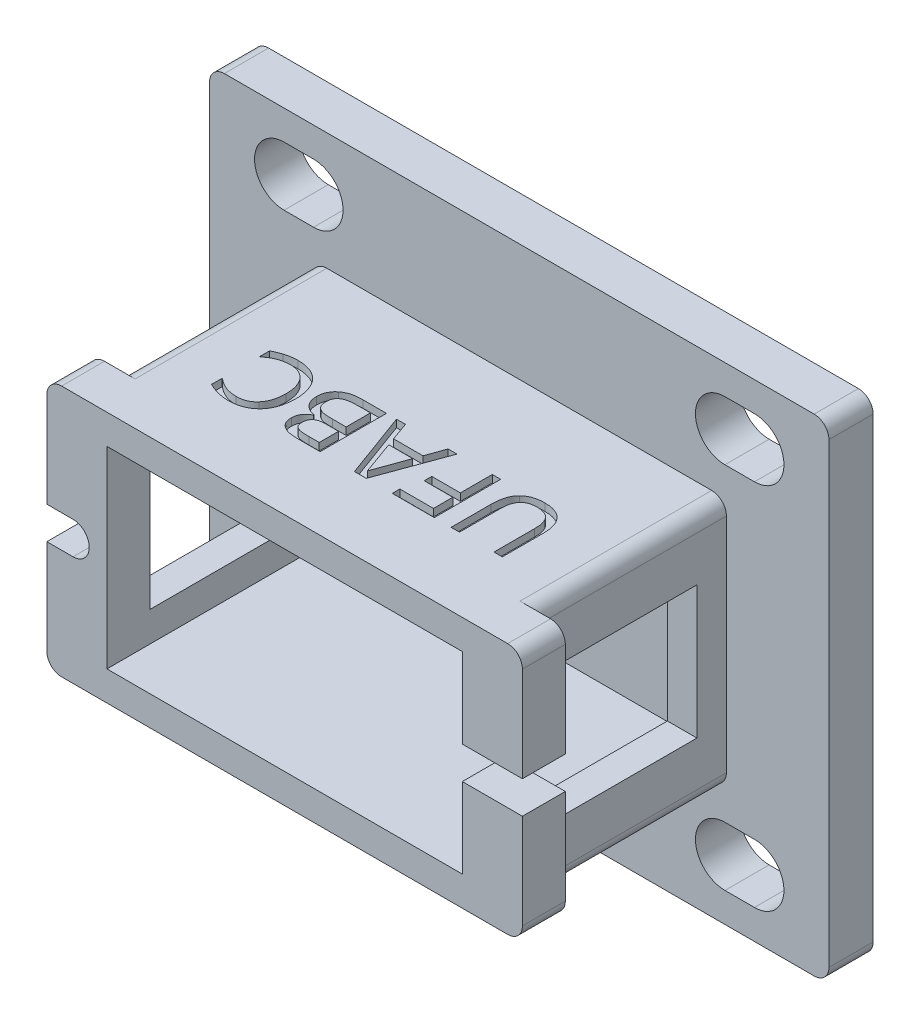
from build123d import *

# Parameters (mm, degrees)
RESSALTO_EXTRUS_O1_DEPTH      = 3
ESBO_O2_W                     = 28.1
ESBO_O2_H                     = 17.08
ESBO_O2_W_2                   = 24.1
ESBO_O2_H_2                   = 13.07
RESSALTO_EXTRUS_O2_DEPTH      = 15.91
RESSALTO_EXTRUS_O3_DEPTH      = 2.91
FURO_COM_FOLGA_DE_00002_D     = 2.199999918
FURO_COM_FOLGA_DE_00002_DEPTH = 4
FURO_COM_FOLGA_DE_00002_TIP   = 0.660946656
CORTE_EXTRUS_O5_DEPTH         = 10
ESPELHAR7_COPY_1_DEPTH        = 10
ESPELHAR7_COPY_2_DEPTH        = 10
CORTE_EXTRUS_O7_START         = -10
CORTE_EXTRUS_O7_DEPTH         = 10
FILETE3_R                     = 1
FILETE4_R                     = 1
FILETE5_R                     = 1
FILETE6_R                     = 1
ESBO_O21_W                    = 11
ESBO_O21_H                    = 9
CORTE_EXTRUS_O8_DEPTH         = 4
CORTE_EXTRUS_O9_DEPTH         = 0.5
CORTE_EXTRUS_O10_DEPTH        = 0.5
ESBO_O25_W                    = 2.3
ESBO_O25_H                    = 2.2
CORTE_EXTRUS_O11_DEPTH        = 3


with BuildPart() as part:
    # Esboço1 → Ressalto-extrusão1 (new body)
    with BuildSketch(Plane.XY):
        with BuildLine():
            Line((-14.468542564, 35.935043394), (25.531457436, 35.935043394))
            ThreePointArc((25.531457436, 35.935043394), (26.238564217, 35.642150175), (26.531457436, 34.935043394))
            Line((26.531457436, 34.935043394), (26.531457436, 3.935043394))
            ThreePointArc((26.531457436, 3.935043394), (26.238564217, 3.227936612), (25.531457436, 2.935043394))
            Line((25.531457436, 2.935043394), (-14.468542564, 2.935043394))
            ThreePointArc((-14.468542564, 2.935043394), (-15.175649345, 3.227936612), (-15.468542564, 3.935043394))
            Line((-15.468542564, 3.935043394), (-15.468542564, 34.935043394))
            ThreePointArc((-15.468542564, 34.935043394), (-15.175649345, 35.642150175), (-14.468542564, 35.935043394))
        make_face()
    extrude(amount=RESSALTO_EXTRUS_O1_DEPTH)

    # Esboço2 → Ressalto-extrusão2 (add)
    with BuildSketch(Plane.XY.offset(3)):
        with Locations((5.531457436, 19.435043394)):
            Rectangle(ESBO_O2_W, ESBO_O2_H)
        with Locations((5.531457436, 19.435043394)):
            Rectangle(ESBO_O2_W_2, ESBO_O2_H_2, mode=Mode.SUBTRACT)
    extrude(amount=RESSALTO_EXTRUS_O2_DEPTH)

    # Esboço3 → Ressalto-extrusão3 (add)
    with BuildSketch(Plane.XY.offset(18.91)):
        with BuildLine():
            Line((-8.518542564, 27.975043394), (-9.593542564, 27.975043394))
            ThreePointArc((-9.593542564, 27.975043394), (-10.300649345, 27.682150175), (-10.593542564, 26.975043394))
            Line((-10.593542564, 26.975043394), (-10.593542564, 11.895043394))
            ThreePointArc((-10.593542564, 11.895043394), (-10.300649345, 11.187936612), (-9.593542564, 10.895043394))
            Line((-9.593542564, 10.895043394), (-8.518542564, 10.895043394))
            Line((-8.518542564, 10.895043394), (-8.518542564, 27.975043394))
        make_face()
        with BuildLine():
            Line((19.581457436, 27.975043394), (20.656457436, 27.975043394))
            ThreePointArc((20.656457436, 27.975043394), (21.363564217, 27.682150175), (21.656457436, 26.975043394))
            Line((21.656457436, 26.975043394), (21.656457436, 11.895043394))
            ThreePointArc((21.656457436, 11.895043394), (21.363564217, 11.187936612), (20.656457436, 10.895043394))
            Line((20.656457436, 10.895043394), (19.581457436, 10.895043394))
            Line((19.581457436, 10.895043394), (19.581457436, 27.975043394))
        make_face()
    extrude(amount=-RESSALTO_EXTRUS_O3_DEPTH)

    # Furo com folga de #00002
    with Locations(Plane.XY.offset(18.91)):
        with Locations((-8.818542564, 19.435043394), (19.881457436, 19.435043394)):
            Hole(FURO_COM_FOLGA_DE_00002_D / 2, depth=FURO_COM_FOLGA_DE_00002_DEPTH)
            with Locations((0, 0, -(FURO_COM_FOLGA_DE_00002_DEPTH + FURO_COM_FOLGA_DE_00002_TIP / 2))):  # 118° drill point
                Cone(0, FURO_COM_FOLGA_DE_00002_D / 2, FURO_COM_FOLGA_DE_00002_TIP, mode=Mode.SUBTRACT)

    # Esboço19 → Corte-extrusão5 (cut)
    with BuildSketch(Plane.XY.offset(3)):
        with BuildLine():
            Line((-10.418542564, 8.935043394), (-8.418542564, 8.935043394))
            ThreePointArc((-8.418542564, 8.935043394), (-6.418542564, 6.935043394), (-8.418542564, 4.935043394))
            Line((-8.418542564, 4.935043394), (-10.418542564, 4.935043394))
            ThreePointArc((-10.418542564, 4.935043394), (-12.418542564, 6.935043394), (-10.418542564, 8.935043394))
        make_face()
    corte_extrus_o5 = extrude(amount=-CORTE_EXTRUS_O5_DEPTH, mode=Mode.SUBTRACT)

    # Espelhar5: Corte-extrusão5 across plane
    add(corte_extrus_o5.mirror(Plane(origin=(0, 19.435043394, 0), x_dir=(0, 0, 1), z_dir=(0, -1, 0))), mode=Mode.SUBTRACT)

    # Espelhar6: Corte-extrusão5 across plane
    add(corte_extrus_o5.mirror(Plane.ZY.offset(-5.531457436)), mode=Mode.SUBTRACT)

    # Espelhar7 copy 1 sketch → Espelhar7 copy 1 (cut)
    with BuildSketch(Plane(origin=(11.062914871, 38.870086787, 3), x_dir=(-1, 0, 0), z_dir=(0, 0, 1))):
        with BuildLine():
            Line((-10.418542564, 8.935043394), (-8.418542564, 8.935043394))
            ThreePointArc((-8.418542564, 8.935043394), (-6.418542564, 6.935043394), (-8.418542564, 4.935043394))
            Line((-8.418542564, 4.935043394), (-10.418542564, 4.935043394))
            ThreePointArc((-10.418542564, 4.935043394), (-12.418542564, 6.935043394), (-10.418542564, 8.935043394))
        make_face()
    extrude(amount=-ESPELHAR7_COPY_1_DEPTH, mode=Mode.SUBTRACT)

    # Espelhar7 copy 2 sketch → Espelhar7 copy 2 (cut)
    with BuildSketch(Plane(origin=(0, 38.870086787, 3), x_dir=(1, 0, 0), z_dir=(0, 0, 1))):
        with BuildLine():
            Line((-10.418542564, -8.935043394), (-8.418542564, -8.935043394))
            ThreePointArc((-8.418542564, -8.935043394), (-6.418542564, -6.935043394), (-8.418542564, -4.935043394))
            Line((-8.418542564, -4.935043394), (-10.418542564, -4.935043394))
            ThreePointArc((-10.418542564, -4.935043394), (-12.418542564, -6.935043394), (-10.418542564, -8.935043394))
        make_face()
    extrude(amount=-ESPELHAR7_COPY_2_DEPTH, mode=Mode.SUBTRACT)

    # Esboço20 → Corte-extrusão7 (cut)
    with BuildSketch(Plane.XY.offset(18.91).offset(CORTE_EXTRUS_O7_START)):
        with BuildLine():
            Line((-10.593542564, 20.535043394), (-8.818542564, 20.535043394))
            ThreePointArc((-8.818542564, 20.535043394), (-7.718542564, 19.435043394), (-8.818542564, 18.335043394))
            Line((-8.818542564, 18.335043394), (-10.593542564, 18.335043394))
            ThreePointArc((-10.593542564, 18.335043394), (-11.693542564, 19.435043394), (-10.593542564, 20.535043394))
        make_face()
    corte_extrus_o7 = extrude(amount=CORTE_EXTRUS_O7_DEPTH, mode=Mode.SUBTRACT)

    # Espelhar8: Corte-extrusão7 across plane
    add(corte_extrus_o7.mirror(Plane.ZY.offset(-5.531457436)), mode=Mode.SUBTRACT)

    # Filete3
    filete3_edges = [part.edges().sort_by_distance(p)[0] for p in [
        (-8.518542564, 27.975043394, 9.5),
    ]]
    fillet(filete3_edges, radius=FILETE3_R)

    # Filete4
    filete4_edges = [part.edges().sort_by_distance(p)[0] for p in [
        (-8.518542564, 10.895043394, 9.5),
    ]]
    fillet(filete4_edges, radius=FILETE4_R)

    # Filete5
    filete5_edges = [part.edges().sort_by_distance(p)[0] for p in [
        (19.581457436, 27.975043394, 9.5),
    ]]
    fillet(filete5_edges, radius=FILETE5_R)

    # Filete6
    filete6_edges = [part.edges().sort_by_distance(p)[0] for p in [
        (19.581457436, 10.895043394, 9.5),
    ]]
    fillet(filete6_edges, radius=FILETE6_R)

    # Esboço21 → Corte-extrusão8 (cut)
    with BuildSketch(Plane(origin=(19.581457436, 0, 0), x_dir=(0, 0, -1), z_dir=(1, 0, 0))):
        with Locations((-10.5, 19.435043394)):
            Rectangle(ESBO_O21_W, ESBO_O21_H)
    corte_extrus_o8 = extrude(amount=-CORTE_EXTRUS_O8_DEPTH, mode=Mode.SUBTRACT)

    # Espelhar9: Corte-extrusão8 across plane
    add(corte_extrus_o8.mirror(Plane.ZY.offset(-5.531457436)), mode=Mode.SUBTRACT)

    # Esboço23 → Corte-extrusão9 (cut)
    # profile 1 of 5: a face of its own
    with BuildSketch(Plane(origin=(0, 27.975043394, 0), x_dir=(1, 0, 0), z_dir=(0, 1, 0))):
        with BuildLine():
            add(Edge.make_bspline(
                [(11.911204271, -11.295193829), (11.912664923, -11.215945249), (11.915497895, -11.062240534), (11.934591413, -10.839376092), (11.968376052, -10.632326775), (12.014703455, -10.440305243), (12.077784505, -10.263540453), (12.158151543, -10.102356361), (12.2551513, -9.955755189), (12.333928691, -9.871326146), (12.373130695, -9.829311709)],
                knots=[0, 0, 0, 0, 1.205303418, 2.337717832, 3.39850228, 4.393290751, 5.338167295, 6.246234061, 7.127273187, 8, 8, 8, 8], degree=3))
            add(Edge.make_bspline(
                [(12.373130695, -9.829311709), (12.412925607, -9.792382267), (12.491977585, -9.719022502), (12.625671434, -9.627283031), (12.768214744, -9.550278061), (12.921766428, -9.489749866), (13.085831213, -9.441937118), (13.262788497, -9.410334024), (13.452207525, -9.388796249), (13.582914862, -9.387001551), (13.650326107, -9.386075949)],
                knots=[0, 0, 0, 0, 0.937269324, 1.861871023, 2.793315159, 3.732182174, 4.709121323, 5.741989093, 6.835449264, 8, 8, 8, 8], degree=3))
            add(Edge.make_bspline(
                [(13.650326107, -9.386075949), (13.718905855, -9.38746418), (13.851936001, -9.390157052), (14.04499494, -9.410285303), (14.224288346, -9.445768281), (14.390252164, -9.494900767), (14.543655857, -9.556573831), (14.682985665, -9.634541501), (14.812388051, -9.722414333), (14.886895719, -9.793799434), (14.923961391, -9.829311709)],
                knots=[0, 0, 0, 0, 1.188028922, 2.304523782, 3.357902557, 4.349916752, 5.299630811, 6.215225934, 7.112120237, 8, 8, 8, 8], degree=3))
            add(Edge.make_bspline(
                [(14.923961391, -9.829311709), (14.963133086, -9.871959257), (15.041544465, -9.957328374), (15.138002803, -10.103407691), (15.219220055, -10.260975039), (15.281461014, -10.433546225), (15.328033852, -10.621904292), (15.363080451, -10.828280288), (15.381612321, -11.055139151), (15.384423613, -11.212983802), (15.385887815, -11.295193829)],
                knots=[0, 0, 0, 0, 0.87938282, 1.760291946, 2.652120213, 3.569875032, 4.542635596, 5.599553239, 6.749778394, 8, 8, 8, 8], degree=3))
            Line((15.385887815, -11.295193829), (15.385887815, -14))
            Line((15.385887815, -14), (14.816267562, -14))
            Line((14.816267562, -14), (14.816267562, -11.26315269))
            add(Edge.make_bspline(
                [(14.816267562, -11.26315269), (14.815438362, -11.205000592), (14.813871973, -11.09514925), (14.806247297, -10.939909776), (14.788976487, -10.804486095), (14.767236215, -10.685478591), (14.736307331, -10.578793281), (14.696465701, -10.479699361), (14.650161846, -10.384265749), (14.610792211, -10.325825117), (14.591089556, -10.296578323)],
                knots=[0, 0, 0, 0, 1.382548273, 2.611681907, 3.691981197, 4.625585456, 5.484844105, 6.326913505, 7.162698717, 8, 8, 8, 8], degree=3))
            add(Edge.make_bspline(
                [(14.591089556, -10.296578323), (14.567051991, -10.26495801), (14.518968119, -10.201705887), (14.430576651, -10.120286896), (14.329335399, -10.052270637), (14.216557264, -9.995997511), (14.0914036, -9.952645729), (13.954890243, -9.920595495), (13.806293158, -9.902070457), (13.703483675, -9.899871267), (13.650326107, -9.898734177)],
                knots=[0, 0, 0, 0, 0.895220104, 1.790765738, 2.697136701, 3.640477896, 4.627423356, 5.679956251, 6.800423063, 8, 8, 8, 8], degree=3))
            add(Edge.make_bspline(
                [(13.650326107, -9.898734177), (13.59656234, -9.899804799), (13.492840021, -9.901870269), (13.343651504, -9.921134729), (13.206348221, -9.950386625), (13.081618129, -9.994106588), (12.969422506, -10.050776052), (12.867908848, -10.118393109), (12.779934276, -10.201398956), (12.730725789, -10.264749721), (12.706002531, -10.296578323)],
                knots=[0, 0, 0, 0, 1.208537762, 2.331539419, 3.377259612, 4.360607104, 5.294546427, 6.197613161, 7.094447339, 8, 8, 8, 8], degree=3))
            add(Edge.make_bspline(
                [(12.706002531, -10.296578323), (12.686280221, -10.326114925), (12.646714579, -10.385369374), (12.600268288, -10.482856241), (12.560628216, -10.585342267), (12.530179229, -10.695674542), (12.508291193, -10.815758831), (12.492595686, -10.947737938), (12.482821353, -11.093307885), (12.481510141, -11.194900606), (12.480824524, -11.248022152)],
                knots=[0, 0, 0, 0, 0.856758264, 1.718773863, 2.601040318, 3.508522331, 4.478200121, 5.546482433, 6.717086775, 8, 8, 8, 8], degree=3))
            Line((12.480824524, -11.248022152), (12.480824524, -14))
            Line((12.480824524, -14), (11.911204271, -14))
            Line((11.911204271, -14), (11.911204271, -11.295193829))
        make_face()
    # profile 2 of 5: a face of its own
    with BuildSketch(Plane(origin=(0, 27.975043394, 0), x_dir=(1, 0, 0), z_dir=(0, 1, 0))):
        Polygon((7.923862499, -13.487341772), (10.202343512, -13.487341772), (10.202343512, -12.17721519), (8.265634651, -12.17721519), (8.265634651, -11.664556962), (10.202343512, -11.664556962), (10.202343512, -9.5), (10.771963765, -9.5), (10.771963765, -14), (7.923862499, -14), align=None)
    # profile 3 of 5: a face of its own
    with BuildSketch(Plane(origin=(0, 27.975043394, 0), x_dir=(1, 0, 0), z_dir=(0, 1, 0))):
        Polygon((3.708672626, -9.5), (4.315674208, -9.5), (4.759799999, -10.753164557), (6.758811075, -10.753164557), (7.202936866, -9.5), (7.809938448, -9.5), (6.160709809, -14), (5.357901265, -14), align=None)
        Polygon((4.946706645, -11.265822785), (5.759305537, -13.527393196), (6.574574524, -11.265822785), align=None, mode=Mode.SUBTRACT)
    # profile 4 of 5: a face of its own
    with BuildSketch(Plane(origin=(0, 27.975043394, 0), x_dir=(1, 0, 0), z_dir=(0, 1, 0))):
        with BuildLine():
            add(Edge.make_bspline(
                [(-0.335631172, -10.875988924), (-0.334119613, -10.82190608), (-0.331181484, -10.716781258), (-0.307582997, -10.563864163), (-0.268791115, -10.420544268), (-0.213190717, -10.287559896), (-0.144195874, -10.165386792), (-0.064853705, -10.053591612), (0.025100198, -9.952494327), (0.093794491, -9.895256627), (0.128075315, -9.866693038)],
                knots=[0, 0, 0, 0, 1.127287555, 2.19119216, 3.217749935, 4.216128277, 5.188346738, 6.137620637, 7.070608386, 8, 8, 8, 8], degree=3))
            add(Edge.make_bspline(
                [(0.128075315, -9.866693038), (0.170527171, -9.835297302), (0.254900171, -9.772898323), (0.390617648, -9.694719254), (0.532264627, -9.630937114), (0.682626305, -9.581215007), (0.846144957, -9.543495484), (1.028173812, -9.518924706), (1.229934078, -9.502622049), (1.371413391, -9.500899736), (1.445322151, -9.5)],
                knots=[0, 0, 0, 0, 0.907275657, 1.803209021, 2.686815759, 3.574022623, 4.52184956, 5.567882121, 6.729462179, 8, 8, 8, 8], degree=3))
            Line((1.445322151, -9.5), (3.025128322, -9.5))
            Line((3.025128322, -9.5), (3.025128322, -14))
            Line((3.025128322, -14), (1.713221676, -14))
            add(Edge.make_bspline(
                [(1.713221676, -14), (1.674059691, -13.999773092), (1.598402081, -13.999334726), (1.488625071, -13.997565012), (1.386566321, -13.994853062), (1.292178865, -13.991692596), (1.205558119, -13.986121177), (1.1263395, -13.97990394), (1.054427555, -13.973256003), (0.969049697, -13.961200491), (0.868534867, -13.942292798), (0.751567893, -13.908740361), (0.637193765, -13.865602322), (0.563624821, -13.829419752), (0.526809493, -13.811313291)],
                knots=[0, 0, 0, 0, 1.160847691, 2.242658619, 3.254318234, 4.187150824, 5.041803839, 5.826891243, 6.542674918, 7.181924206, 8.382303751, 9.570932517, 10.78444746, 12, 12, 12, 12], degree=3))
            add(Edge.make_bspline(
                [(0.526809493, -13.811313291), (0.488093167, -13.788973504), (0.413355356, -13.745848886), (0.315967629, -13.664657367), (0.233759875, -13.575972867), (0.169751762, -13.475841962), (0.121120761, -13.366548462), (0.088053294, -13.247416568), (0.066948637, -13.118723723), (0.064414078, -13.029656433), (0.063103005, -12.983583861)],
                knots=[0, 0, 0, 0, 1.067384047, 2.060473116, 3.019932043, 3.948993602, 4.889261412, 5.870823892, 6.898623516, 8, 8, 8, 8], degree=3))
            add(Edge.make_bspline(
                [(0.063103005, -12.983583861), (0.064644295, -12.931472884), (0.067633833, -12.830396675), (0.100433392, -12.685747744), (0.149657217, -12.552114298), (0.222409659, -12.432322106), (0.311502548, -12.324901742), (0.412589754, -12.226650807), (0.528352677, -12.140551241), (0.613441971, -12.093481032), (0.656754113, -12.069521361)],
                knots=[0, 0, 0, 0, 1.083776773, 2.102130014, 3.074405323, 4.039008105, 5.005312373, 5.975719527, 6.969601001, 8, 8, 8, 8], degree=3))
            Line((0.656754113, -12.069521361), (0.656754113, -12.045490506))
            add(Edge.make_bspline(
                [(0.656754113, -12.045490506), (0.619239628, -12.037111917), (0.545630687, -12.020671891), (0.439066982, -11.987453793), (0.33875451, -11.947656473), (0.244316515, -11.901038873), (0.156244062, -11.847634193), (0.074044807, -11.787822162), (-0.002211327, -11.721712213), (-0.071548388, -11.648626862), (-0.133864682, -11.569865519), (-0.187361053, -11.485102522), (-0.23430202, -11.396626702), (-0.270254556, -11.301808465), (-0.30032007, -11.202984889), (-0.320191668, -11.098239651), (-0.333011939, -10.988748124), (-0.334748207, -10.914000996), (-0.335631172, -10.875988924)],
                knots=[0, 0, 0, 0, 1.099100952, 2.156597853, 3.188732086, 4.183021528, 5.165361869, 6.131142649, 7.087482676, 8.047842614, 9.008689807, 9.955000466, 10.911453432, 11.867981682, 12.850651833, 13.862493665, 14.912987764, 16, 16, 16, 16], degree=3))
        make_face()
        with BuildLine():
            add(Edge.make_bspline(
                [(0.689685284, -12.905261076), (0.690387997, -12.931694499), (0.691735478, -12.982381648), (0.70145007, -13.055557459), (0.718270452, -13.122112327), (0.741149904, -13.183063924), (0.772953834, -13.237342894), (0.812947534, -13.286144441), (0.860784508, -13.329937126), (0.897859122, -13.353479468), (0.916643353, -13.365407437)],
                knots=[0, 0, 0, 0, 1.174178758, 2.251534833, 3.27123945, 4.218438366, 5.133930649, 6.05198084, 7.013016183, 8, 8, 8, 8], degree=3))
            add(Edge.make_bspline(
                [(0.916643353, -13.365407437), (0.940973475, -13.378506823), (0.990621673, -13.405237514), (1.07255908, -13.434048007), (1.161473989, -13.455397816), (1.258667834, -13.469107358), (1.365678615, -13.477721813), (1.483876346, -13.482034863), (1.613788911, -13.487513695), (1.704314041, -13.487400675), (1.751493037, -13.487341772)],
                knots=[0, 0, 0, 0, 0.776384195, 1.584294465, 2.434510404, 3.345747647, 4.342456518, 5.453641736, 6.672914062, 8, 8, 8, 8], degree=3))
            Line((1.751493037, -13.487341772), (2.455508069, -13.487341772))
            Line((2.455508069, -13.487341772), (2.455508069, -12.17721519))
            Line((2.455508069, -12.17721519), (1.691860917, -12.17721519))
            add(Edge.make_bspline(
                [(1.691860917, -12.17721519), (1.647950026, -12.177555747), (1.564838509, -12.17820033), (1.447199634, -12.18295991), (1.343926822, -12.193071274), (1.252814828, -12.205028755), (1.169845925, -12.222624333), (1.092459013, -12.25017516), (1.016862476, -12.283488637), (0.969753183, -12.312248274), (0.946014398, -12.326740506)],
                knots=[0, 0, 0, 0, 1.364632982, 2.582883534, 3.657160853, 4.5881174, 5.438127254, 6.286585674, 7.136595527, 8, 8, 8, 8], degree=3))
            add(Edge.make_bspline(
                [(0.946014398, -12.326740506), (0.923818441, -12.342397823), (0.880500677, -12.372954739), (0.825413456, -12.429424895), (0.780336504, -12.492411469), (0.745322479, -12.562473472), (0.721140229, -12.639667091), (0.702059352, -12.722302713), (0.691658074, -12.811840964), (0.690356158, -12.873492306), (0.689685284, -12.905261076)],
                knots=[0, 0, 0, 0, 0.9824893, 1.917432139, 2.842122762, 3.779534102, 4.741522292, 5.766377554, 6.849020408, 8, 8, 8, 8], degree=3))
        make_face(mode=Mode.SUBTRACT)
        with BuildLine():
            add(Edge.make_bspline(
                [(0.290951107, -10.850178006), (0.291935045, -10.892652151), (0.293806665, -10.97344524), (0.3087782, -11.087736358), (0.333119751, -11.188757638), (0.368760721, -11.277788735), (0.419944436, -11.356496559), (0.487012568, -11.426861907), (0.569961727, -11.491899601), (0.633918122, -11.526933299), (0.667434493, -11.545292722)],
                knots=[0, 0, 0, 0, 1.208368798, 2.298524156, 3.273208546, 4.159048888, 5.013807433, 5.927688613, 6.914004493, 8, 8, 8, 8], degree=3))
            add(Edge.make_bspline(
                [(0.667434493, -11.545292722), (0.692417599, -11.557150973), (0.744214466, -11.581736397), (0.828792555, -11.608038214), (0.920534976, -11.630215145), (1.020810346, -11.643380748), (1.130418215, -11.652858525), (1.250317128, -11.660169045), (1.38122594, -11.663106411), (1.472022676, -11.664061013), (1.519194777, -11.664556962)],
                knots=[0, 0, 0, 0, 0.764147773, 1.584288976, 2.444280202, 3.372814254, 4.378149364, 5.488059533, 6.694958479, 8, 8, 8, 8], degree=3))
            Line((1.519194777, -11.664556962), (2.455508069, -11.664556962))
            Line((2.455508069, -11.664556962), (2.455508069, -10.012658228))
            Line((2.455508069, -10.012658228), (1.666940031, -10.012658228))
            add(Edge.make_bspline(
                [(1.666940031, -10.012658228), (1.604630841, -10.013203025), (1.485902477, -10.014241121), (1.316380602, -10.021096932), (1.16457072, -10.033041378), (1.029346551, -10.050780319), (0.908347055, -10.073895153), (0.800113953, -10.10741655), (0.701783938, -10.147037145), (0.64386652, -10.183023799), (0.615812657, -10.200454905)],
                knots=[0, 0, 0, 0, 1.381990905, 2.633343819, 3.76232929, 4.758099937, 5.657572934, 6.490174541, 7.268675336, 8, 8, 8, 8], degree=3))
            add(Edge.make_bspline(
                [(0.615812657, -10.200454905), (0.589284764, -10.220106045), (0.537784584, -10.258255972), (0.469494803, -10.322622424), (0.412760955, -10.391585452), (0.366999115, -10.465976338), (0.333054369, -10.548094586), (0.307650845, -10.639098716), (0.294220557, -10.741199627), (0.292073628, -10.812761764), (0.290951107, -10.850178006)],
                knots=[0, 0, 0, 0, 1.040338585, 2.019671262, 2.950347644, 3.848778409, 4.762660536, 5.743109515, 6.819985475, 8, 8, 8, 8], degree=3))
        make_face(mode=Mode.SUBTRACT)
    # profile 5 of 5: a face of its own
    with BuildSketch(Plane(origin=(0, 27.975043394, 0), x_dir=(1, 0, 0), z_dir=(0, 1, 0))):
        with BuildLine():
            add(Edge.make_bspline(
                [(-4.607783071, -9.783920095), (-4.55550009, -9.761229298), (-4.455826024, -9.717970785), (-4.333054622, -9.662215077), (-4.234674868, -9.619482028), (-4.152800543, -9.586227283), (-4.059932576, -9.553664045), (-3.994303426, -9.532483275), (-3.959840033, -9.521360759)],
                knots=[0, 0, 0, 0, 1.466295932, 2.795396815, 3.468894682, 4.225765994, 5.068308445, 6, 6, 6, 6], degree=3))
            add(Edge.make_bspline(
                [(-3.959840033, -9.521360759), (-3.896538547, -9.503414272), (-3.765539552, -9.466274987), (-3.595613481, -9.43106619), (-3.451458372, -9.407050489), (-3.335865972, -9.394759702), (-3.215268018, -9.387792961), (-3.133009803, -9.38665485), (-3.091169147, -9.386075949)],
                knots=[0, 0, 0, 0, 1.341774408, 2.776729465, 3.536831711, 4.322078055, 5.146524697, 6, 6, 6, 6], degree=3))
            add(Edge.make_bspline(
                [(-3.091169147, -9.386075949), (-3.011884614, -9.387782173), (-2.856739026, -9.391120946), (-2.629538542, -9.417355365), (-2.41348019, -9.460509541), (-2.208716347, -9.52211437), (-2.015141401, -9.601037933), (-1.834291286, -9.700393936), (-1.666098121, -9.819733398), (-1.566655831, -9.914381842), (-1.516703166, -9.961926424)],
                knots=[0, 0, 0, 0, 1.104487459, 2.161283541, 3.181953727, 4.170622339, 5.136339546, 6.089123888, 7.040113063, 8, 8, 8, 8], degree=3))
            add(Edge.make_bspline(
                [(-1.516703166, -9.961926424), (-1.470033886, -10.012796132), (-1.375582752, -10.115748257), (-1.255119749, -10.29294355), (-1.151653734, -10.489620718), (-1.078019083, -10.666922783), (-1.027835163, -10.817537947), (-0.994546703, -10.936592296), (-0.967585424, -11.060341662), (-0.943674583, -11.188418673), (-0.927948669, -11.321419105), (-0.913537191, -11.458686737), (-0.907108914, -11.600710023), (-0.905875442, -11.696891423), (-0.905251425, -11.745549842)],
                knots=[0, 0, 0, 0, 1.283981998, 2.598573533, 3.974935642, 5.416182384, 6.167275585, 6.929818055, 7.716466638, 8.524732047, 9.354418832, 10.209085012, 11.09397147, 12, 12, 12, 12], degree=3))
            add(Edge.make_bspline(
                [(-0.905251425, -11.745549842), (-0.907005817, -11.8370158), (-0.910432984, -12.015692643), (-0.94077339, -12.276042579), (-0.987556953, -12.522157471), (-1.05675747, -12.752166382), (-1.142326621, -12.966734171), (-1.247438901, -13.16347381), (-1.367880182, -13.344576679), (-1.46318129, -13.451295073), (-1.510472944, -13.504252373)],
                knots=[0, 0, 0, 0, 1.151417489, 2.24927006, 3.296286549, 4.302183159, 5.269284258, 6.200204858, 7.106880388, 8, 8, 8, 8], degree=3))
            add(Edge.make_bspline(
                [(-1.510472944, -13.504252373), (-1.559218973, -13.552089352), (-1.656766776, -13.647818014), (-1.823764924, -13.769406776), (-2.004191828, -13.875289453), (-2.199614679, -13.962009822), (-2.40726214, -14.031021295), (-2.62667168, -14.078137308), (-2.85652553, -14.108713181), (-3.013635107, -14.11216295), (-3.093839242, -14.113924051)],
                knots=[0, 0, 0, 0, 0.93871752, 1.878508555, 2.833551137, 3.813034811, 4.814835004, 5.839034992, 6.896831544, 8, 8, 8, 8], degree=3))
            add(Edge.make_bspline(
                [(-3.093839242, -14.113924051), (-3.153801829, -14.112886278), (-3.273938057, -14.110807081), (-3.453763205, -14.094258705), (-3.63347822, -14.067275886), (-3.815143635, -14.030158694), (-4.001051765, -13.977354603), (-4.195373122, -13.909919082), (-4.399546522, -13.826523061), (-4.536909804, -13.760714525), (-4.607783071, -13.726760285)],
                knots=[0, 0, 0, 0, 0.912202434, 1.827615603, 2.744952038, 3.676252853, 4.646607392, 5.682969071, 6.804516396, 8, 8, 8, 8], degree=3))
            Line((-4.607783071, -13.726760285), (-4.607783071, -13.03164557))
            Line((-4.607783071, -13.03164557), (-4.563281488, -13.03164557))
            add(Edge.make_bspline(
                [(-4.563281488, -13.03164557), (-4.502859759, -13.078879255), (-4.385298844, -13.170780551), (-4.201694909, -13.289468835), (-4.01947327, -13.388659171), (-3.836703699, -13.468920727), (-3.650186762, -13.527402068), (-3.458934828, -13.570857902), (-3.260930543, -13.595735325), (-3.126836626, -13.599410235), (-3.059128007, -13.601265823)],
                knots=[0, 0, 0, 0, 1.120017692, 2.179187939, 3.189630155, 4.148627372, 5.09034715, 6.040952444, 7.010809685, 8, 8, 8, 8], degree=3))
            add(Edge.make_bspline(
                [(-3.059128007, -13.601265823), (-3.004164795, -13.599994591), (-2.896771693, -13.597510721), (-2.740077889, -13.575283104), (-2.59143524, -13.541026632), (-2.450590522, -13.49203198), (-2.317837161, -13.427226843), (-2.192411605, -13.347683467), (-2.074553943, -13.251538467), (-2.003956257, -13.177236001), (-1.96794921, -13.139339399)],
                knots=[0, 0, 0, 0, 1.077855129, 2.106030601, 3.098592913, 4.066913022, 5.024926134, 5.99056578, 6.975125154, 8, 8, 8, 8], degree=3))
            add(Edge.make_bspline(
                [(-1.96794921, -13.139339399), (-1.93467886, -13.099093996), (-1.866814836, -13.017002435), (-1.780515057, -12.877662352), (-1.707403427, -12.722763846), (-1.643738571, -12.553916005), (-1.593330713, -12.370446222), (-1.557052189, -12.173068235), (-1.535653861, -11.962005604), (-1.533132695, -11.816803063), (-1.531833704, -11.741989715)],
                knots=[0, 0, 0, 0, 0.837237299, 1.707775599, 2.621307695, 3.582524724, 4.600132761, 5.670256458, 6.799635929, 8, 8, 8, 8], degree=3))
            add(Edge.make_bspline(
                [(-1.531833704, -11.741989715), (-1.53322567, -11.664186396), (-1.535915839, -11.513820711), (-1.560559887, -11.297195551), (-1.598429847, -11.096832775), (-1.655316259, -10.914476263), (-1.723092817, -10.74789811), (-1.800338542, -10.597417522), (-1.886080919, -10.461761309), (-1.953641259, -10.383073606), (-1.986639874, -10.344640032)],
                knots=[0, 0, 0, 0, 1.241996245, 2.400329698, 3.477194359, 4.49324066, 5.445166335, 6.345693648, 7.191984226, 8, 8, 8, 8], degree=3))
            add(Edge.make_bspline(
                [(-1.986639874, -10.344640032), (-2.022009283, -10.308431856), (-2.092290311, -10.236484152), (-2.211591313, -10.145216117), (-2.338959091, -10.067753246), (-2.474506082, -10.005806198), (-2.61621162, -9.957623295), (-2.762706932, -9.924202184), (-2.912837268, -9.902920286), (-3.014258844, -9.900136657), (-3.065358229, -9.898734177)],
                knots=[0, 0, 0, 0, 1.009916827, 2.006762181, 2.990523006, 3.982176514, 4.977241329, 5.97482617, 6.979653641, 8, 8, 8, 8], degree=3))
            add(Edge.make_bspline(
                [(-3.065358229, -9.898734177), (-3.13546017, -9.900405563), (-3.274104477, -9.903711151), (-3.478493188, -9.93119339), (-3.676357308, -9.975623534), (-3.867629533, -10.038314225), (-4.052584343, -10.118432637), (-4.230610738, -10.21789238), (-4.40410348, -10.332646069), (-4.511591334, -10.422773789), (-4.565951583, -10.46835443)],
                knots=[0, 0, 0, 0, 1.024509756, 2.026226982, 3.008985297, 3.985550876, 4.964550213, 5.950748031, 6.963623856, 8, 8, 8, 8], degree=3))
            Line((-4.565951583, -10.46835443), (-4.607783071, -10.46835443))
            Line((-4.607783071, -10.46835443), (-4.607783071, -9.783920095))
        make_face()
    extrude(amount=-CORTE_EXTRUS_O9_DEPTH, mode=Mode.SUBTRACT)

    # Esboço24 → Corte-extrusão10 (cut)
    # profile 1 of 7: a face of its own
    with BuildSketch(Plane.XZ.offset(-10.895043394)):
        Polygon((16.585254904, 9.5), (16.142216929, 9.5), (16.142216929, 12.518196203), (15.188993037, 10.474683544), (14.917632277, 10.474683544), (13.971330853, 12.518196203), (13.971330853, 9.5), (13.528292879, 9.5), (13.528292879, 13), (14.167236708, 13), (15.081002531, 11.05963212), (15.96500174, 13), (16.585254904, 13), align=None)
    # profile 2 of 7: a face of its own
    with BuildSketch(Plane.XZ.offset(-10.895043394)):
        Polygon((12.996647309, 9.5), (12.524534967, 9.5), (12.179103796, 10.474683544), (10.624317404, 10.474683544), (10.278886233, 9.5), (9.806773891, 9.5), (11.089507277, 13), (11.713913923, 13), align=None)
        Polygon((12.033731961, 10.873417722), (11.4017106, 12.63241693), (10.767612499, 10.873417722), align=None, mode=Mode.SUBTRACT)
    # profile 3 of 7: a face of its own
    with BuildSketch(Plane.XZ.offset(-10.895043394)):
        with BuildLine():
            add(Edge.make_bspline(
                [(9.585254904, 9.720826741), (9.544558654, 9.703247426), (9.466887046, 9.669696088), (9.371667637, 9.62551656), (9.295202052, 9.592107125), (9.231204949, 9.567276116), (9.159176679, 9.541668593), (9.108113612, 9.52524063), (9.081299208, 9.516613924)],
                knots=[0, 0, 0, 0, 1.466218801, 2.79837997, 3.471842409, 4.225859324, 5.068357454, 6, 6, 6, 6], degree=3))
            add(Edge.make_bspline(
                [(9.081299208, 9.516613924), (9.032042923, 9.502767186), (8.930063354, 9.47409908), (8.798407921, 9.445231462), (8.68606083, 9.427836142), (8.596450555, 9.418164684), (8.502418312, 9.412700619), (8.438439598, 9.411835543), (8.405666296, 9.411392405)],
                knots=[0, 0, 0, 0, 1.341692312, 2.777822261, 3.530957039, 4.322171559, 5.140526999, 6, 6, 6, 6], degree=3))
            add(Edge.make_bspline(
                [(8.405666296, 9.411392405), (8.344003462, 9.412728823), (8.223340371, 9.415343952), (8.046588012, 9.435617238), (7.878537716, 9.469685353), (7.718521244, 9.515997635), (7.568376516, 9.578639561), (7.427954611, 9.656002591), (7.2972713, 9.748675643), (7.219931571, 9.822295019), (7.181081645, 9.859276108)],
                knots=[0, 0, 0, 0, 1.104385245, 2.161083527, 3.181659255, 4.173014903, 5.140224961, 6.089300729, 7.040201895, 8, 8, 8, 8], degree=3))
            add(Edge.make_bspline(
                [(7.181081645, 9.859276108), (7.144775626, 9.898837424), (7.07129807, 9.97890318), (6.977840105, 10.116615648), (6.896942881, 10.269134205), (6.839941749, 10.406933487), (6.800699002, 10.524249299), (6.775156482, 10.617165229), (6.753678077, 10.713503812), (6.736574805, 10.813361924), (6.722834882, 10.916582863), (6.712044993, 11.023436097), (6.706928685, 11.133882164), (6.70598532, 11.208692183), (6.705508069, 11.246538766)],
                knots=[0, 0, 0, 0, 1.283960364, 2.59852975, 3.969994339, 5.411216797, 6.162297344, 6.930149855, 7.716785184, 8.524073837, 9.354463407, 10.209115187, 11.093986735, 12, 12, 12, 12], degree=3))
            add(Edge.make_bspline(
                [(6.705508069, 11.246538766), (6.706877977, 11.317677826), (6.709554064, 11.456646496), (6.733051118, 11.658931405), (6.769637138, 11.850079446), (6.823303432, 12.028789709), (6.89009368, 12.195784643), (6.97144477, 12.349248847), (7.065353698, 12.490214041), (7.139461235, 12.573225434), (7.176235917, 12.614418513)],
                knots=[0, 0, 0, 0, 1.151470104, 2.249372842, 3.292771279, 4.298713855, 5.265859146, 6.200122615, 7.106839577, 8, 8, 8, 8], degree=3))
            add(Edge.make_bspline(
                [(7.176235917, 12.614418513), (7.214148367, 12.651627422), (7.290016623, 12.726087793), (7.419921106, 12.820621023), (7.559923705, 12.902958894), (7.711871553, 12.969793742), (7.873336755, 13.023362728), (8.044079571, 13.060914503), (8.223175682, 13.084507589), (8.345365415, 13.087221929), (8.407743037, 13.088607595)],
                knots=[0, 0, 0, 0, 0.93877872, 1.878631025, 2.833735871, 3.807891388, 4.809756893, 5.838894108, 6.896759623, 8, 8, 8, 8], degree=3))
            add(Edge.make_bspline(
                [(8.407743037, 13.088607595), (8.454378086, 13.087782502), (8.547812327, 13.086129413), (8.687748829, 13.07352578), (8.827192224, 13.051529796), (8.968168226, 13.022535971), (9.112973819, 12.982480786), (9.264296426, 12.930026756), (9.42329123, 12.865071507), (9.530130601, 12.8138884), (9.585254904, 12.787480222)],
                knots=[0, 0, 0, 0, 0.912280266, 1.827771541, 2.74586349, 3.672824498, 4.642053622, 5.682771375, 6.804414393, 8, 8, 8, 8], degree=3))
            Line((9.585254904, 12.787480222), (9.585254904, 12.246835443))
            Line((9.585254904, 12.246835443), (9.550642562, 12.246835443))
            add(Edge.make_bspline(
                [(9.550642562, 12.246835443), (9.503652069, 12.283582898), (9.412223946, 12.35508142), (9.269363228, 12.447254799), (9.127732658, 12.524954041), (8.98468251, 12.585713812), (8.840146696, 12.632601086), (8.691466647, 12.66622834), (8.537707021, 12.685577758), (8.433409039, 12.688432142), (8.38074541, 12.689873418)],
                knots=[0, 0, 0, 0, 1.120106368, 2.179360474, 3.189882691, 4.151225788, 5.094345944, 6.040797339, 7.010731367, 8, 8, 8, 8], degree=3))
            add(Edge.make_bspline(
                [(8.38074541, 12.689873418), (8.338012673, 12.688779743), (8.254547516, 12.686643589), (8.132422118, 12.670823846), (8.017098673, 12.642744375), (7.907421794, 12.604990701), (7.804190348, 12.554489084), (7.706631428, 12.492648344), (7.614965906, 12.41786176), (7.56005638, 12.360071941), (7.53205079, 12.33059731)],
                knots=[0, 0, 0, 0, 1.077777966, 2.105105195, 3.098943798, 4.067194587, 5.025139116, 5.990709632, 6.975198523, 8, 8, 8, 8], degree=3))
            add(Edge.make_bspline(
                [(7.53205079, 12.33059731), (7.506159851, 12.29930231), (7.453348165, 12.235467556), (7.38639769, 12.126894412), (7.328587415, 12.006776774), (7.279056562, 11.875356006), (7.240900348, 11.732449692), (7.21239765, 11.579070253), (7.195839339, 11.414888534), (7.193866378, 11.301956335), (7.192849841, 11.243769778)],
                knots=[0, 0, 0, 0, 0.837152518, 1.707602665, 2.623111512, 3.584231206, 4.60047704, 5.670492373, 6.799757481, 8, 8, 8, 8], degree=3))
            add(Edge.make_bspline(
                [(7.192849841, 11.243769778), (7.193935529, 11.183257769), (7.196033771, 11.066309932), (7.215186003, 10.897575827), (7.244834744, 10.741662773), (7.287846328, 10.599167601), (7.341627692, 10.470203274), (7.40182554, 10.353395651), (7.468368815, 10.248031364), (7.520920205, 10.186833317), (7.546587974, 10.156942247)],
                knots=[0, 0, 0, 0, 1.241862862, 2.400071917, 3.481468856, 4.496024571, 5.449649898, 6.345871311, 7.192071002, 8, 8, 8, 8], degree=3))
            add(Edge.make_bspline(
                [(7.546587974, 10.156942247), (7.574097514, 10.128780333), (7.628760535, 10.072821007), (7.721550203, 10.001834758), (7.820614031, 9.941585858), (7.926039468, 9.893404821), (8.036254887, 9.85592923), (8.150195685, 9.829935032), (8.266963724, 9.813382445), (8.345847172, 9.8112174), (8.385591138, 9.810126582)],
                knots=[0, 0, 0, 0, 1.009916827, 2.006762181, 2.990523006, 3.982176514, 4.977241329, 5.97482617, 6.979653641, 8, 8, 8, 8], degree=3))
            add(Edge.make_bspline(
                [(8.385591138, 9.810126582), (8.440114732, 9.811426789), (8.547948919, 9.813998277), (8.706919922, 9.83536987), (8.860806808, 9.869939551), (9.009601604, 9.918651202), (9.153537883, 9.981225189), (9.292390297, 10.05793459), (9.426897492, 10.14787136), (9.510409912, 10.217758207), (9.552719303, 10.253164557)],
                knots=[0, 0, 0, 0, 1.024484406, 2.026176845, 3.008910844, 3.985452258, 4.964427371, 5.954398846, 6.9636495, 8, 8, 8, 8], degree=3))
            Line((9.552719303, 10.253164557), (9.585254904, 10.253164557))
            Line((9.585254904, 10.253164557), (9.585254904, 9.720826741))
        make_face()
    # profile 4 of 7: a face of its own
    with BuildSketch(Plane.XZ.offset(-10.895043394)):
        Polygon((6.262470094, 13.132911392), (4.60730791, 8.791139241), (4.180191613, 8.791139241), (5.827739081, 13.132911392), align=None)
    # profile 5 of 7: a face of its own
    with BuildSketch(Plane.XZ.offset(-10.895043394)):
        with BuildLine():
            add(Edge.make_bspline(
                [(4.002976423, 11.246538766), (4.00227831, 11.207291012), (4.000896387, 11.129599551), (3.990863669, 11.01427771), (3.975129297, 10.90170294), (3.953089532, 10.791791558), (3.923831044, 10.685052067), (3.888277978, 10.580877926), (3.847220851, 10.47901625), (3.798340775, 10.38125263), (3.745632156, 10.286991489), (3.686867577, 10.198642526), (3.625899106, 10.114260773), (3.558704514, 10.036753646), (3.488285183, 9.963841297), (3.413227028, 9.896384528), (3.333760521, 9.834737217), (3.277753739, 9.797997317), (3.249811866, 9.779667722)],
                knots=[0, 0, 0, 0, 1.094386419, 2.166352773, 3.225612914, 4.262951279, 5.29010093, 6.309582837, 7.331255611, 8.349985861, 9.35564614, 10.340819852, 11.307366477, 12.256578994, 13.198544422, 14.132652644, 15.068377412, 16, 16, 16, 16], degree=3))
            add(Edge.make_bspline(
                [(3.249811866, 9.779667722), (3.209639652, 9.755761493), (3.12896521, 9.707752647), (2.998945791, 9.650372088), (2.863046322, 9.601549345), (2.744148375, 9.569769626), (2.643614967, 9.549865312), (2.562226142, 9.535752021), (2.474640063, 9.524942567), (2.3813444, 9.516285113), (2.282387547, 9.508173661), (2.177543409, 9.504026317), (2.067023583, 9.499953953), (1.991311671, 9.499984406), (1.952541296, 9.5)],
                knots=[0, 0, 0, 0, 1.249514912, 2.509294574, 3.793991945, 5.110113964, 5.796508351, 6.535277615, 7.319286112, 8.156458227, 9.041765045, 9.974846945, 10.962964465, 12, 12, 12, 12], degree=3))
            Line((1.952541296, 9.5), (1.07892579, 9.5))
            Line((1.07892579, 9.5), (1.07892579, 13))
            Line((1.07892579, 13), (1.943542088, 13))
            add(Edge.make_bspline(
                [(1.943542088, 13), (1.984618314, 12.999702755), (2.064708482, 12.999123188), (2.181716311, 12.995538156), (2.292310635, 12.990372865), (2.396167532, 12.981948988), (2.493569692, 12.971521652), (2.584635554, 12.959491008), (2.669129788, 12.944226305), (2.771504036, 12.921241144), (2.890395554, 12.88853804), (3.022658815, 12.840382698), (3.144580311, 12.787331518), (3.218584529, 12.743684558), (3.254657594, 12.722409019)],
                knots=[0, 0, 0, 0, 1.089001933, 2.123329097, 3.103368211, 4.023940312, 4.885306527, 5.700303407, 6.458688716, 7.16072189, 8.481727402, 9.7240978, 10.890620442, 12, 12, 12, 12], degree=3))
            add(Edge.make_bspline(
                [(3.254657594, 12.722409019), (3.283507573, 12.7033676), (3.34079104, 12.665559651), (3.422258815, 12.60298197), (3.498190294, 12.535008776), (3.569575463, 12.462853561), (3.636751795, 12.386710326), (3.697136539, 12.304450208), (3.754379115, 12.218644453), (3.806107832, 12.127953282), (3.852871446, 12.032910221), (3.892747977, 11.933288412), (3.92672627, 11.829416934), (3.9554475, 11.721386791), (3.976505995, 11.608634651), (3.991506676, 11.491673938), (4.001825388, 11.370635584), (4.00258883, 11.288326384), (4.002976423, 11.246538766)],
                knots=[0, 0, 0, 0, 0.957879179, 1.901930023, 2.844137672, 3.7802698, 4.714017599, 5.655443513, 6.606207826, 7.571615578, 8.546971036, 9.539824731, 10.542965642, 11.574551414, 12.635708897, 13.719331871, 14.84212591, 16, 16, 16, 16], degree=3))
        make_face()
        with BuildLine():
            add(Edge.make_bspline(
                [(3.515634651, 11.253461234), (3.515316054, 11.287164033), (3.51469124, 11.353260084), (3.507429164, 11.450273627), (3.496478569, 11.543147187), (3.48149523, 11.631993511), (3.461316061, 11.716839385), (3.436590952, 11.797556726), (3.407174456, 11.874208712), (3.374290796, 11.947157674), (3.335806343, 12.015820674), (3.293560452, 12.081087044), (3.247217099, 12.142745908), (3.196570787, 12.200646561), (3.140547766, 12.254081762), (3.080682561, 12.304265136), (3.016775154, 12.351412405), (2.971083568, 12.378511906), (2.947992246, 12.392207278)],
                knots=[0, 0, 0, 0, 1.208007165, 2.369076361, 3.485435189, 4.559812397, 5.597150468, 6.609786471, 7.58380959, 8.538854455, 9.475705635, 10.402680455, 11.324213432, 12.238589921, 13.157110554, 14.096587607, 15.0380656, 16, 16, 16, 16], degree=3))
            add(Edge.make_bspline(
                [(2.947992246, 12.392207278), (2.913455524, 12.410843383), (2.844576323, 12.448010778), (2.735972499, 12.492267027), (2.625037045, 12.529848854), (2.508941058, 12.556473924), (2.385907285, 12.576653881), (2.253011235, 12.5907552), (2.108659794, 12.600042356), (2.008629065, 12.600847701), (1.956694777, 12.601265823)],
                knots=[0, 0, 0, 0, 0.918044582, 1.830925839, 2.741374704, 3.657207721, 4.615390486, 5.658695052, 6.784433501, 8, 8, 8, 8], degree=3))
            Line((1.956694777, 12.601265823), (1.521963765, 12.601265823))
            Line((1.521963765, 12.601265823), (1.521963765, 9.898734177))
            Line((1.521963765, 9.898734177), (1.956694777, 9.898734177))
            add(Edge.make_bspline(
                [(1.956694777, 9.898734177), (2.010708095, 9.89909011), (2.115137806, 9.899778274), (2.266398712, 9.910005768), (2.406908179, 9.924782113), (2.538097292, 9.945664182), (2.661274767, 9.976539407), (2.778819646, 10.016415016), (2.891111282, 10.067734456), (2.961292242, 10.110104008), (2.996449524, 10.131329114)],
                knots=[0, 0, 0, 0, 1.199117433, 2.31838169, 3.364579942, 4.335785202, 5.265306948, 6.180784859, 7.088660772, 8, 8, 8, 8], degree=3))
            add(Edge.make_bspline(
                [(2.996449524, 10.131329114), (3.017674472, 10.145553969), (3.059774081, 10.173768918), (3.118391368, 10.221202557), (3.173495275, 10.27104951), (3.224186075, 10.32450565), (3.270585314, 10.381656628), (3.313619021, 10.441477275), (3.351684673, 10.505199299), (3.386679001, 10.57175448), (3.416958833, 10.642433616), (3.44328999, 10.717181652), (3.466427087, 10.795842672), (3.483786348, 10.879296882), (3.498952047, 10.966704971), (3.50781682, 11.058574184), (3.514603505, 11.15459977), (3.515285529, 11.219989062), (3.515634651, 11.253461234)],
                knots=[0, 0, 0, 0, 0.946631751, 1.877640736, 2.791840547, 3.699334301, 4.605012542, 5.518732121, 6.428158429, 7.353927578, 8.304030388, 9.275188661, 10.29024804, 11.340409526, 12.432939044, 13.576758541, 14.759565155, 16, 16, 16, 16], degree=3))
        make_face(mode=Mode.SUBTRACT)
    # profile 6 of 7: a face of its own
    with BuildSketch(Plane.XZ.offset(-10.895043394)):
        Polygon((0.547280221, 9.5), (0.075167879, 9.5), (-0.270263292, 10.474683544), (-1.825049685, 10.474683544), (-2.170480855, 9.5), (-2.642593197, 9.5), (-1.359859811, 13), (-0.735453166, 13), align=None)
        Polygon((-0.415635128, 10.873417722), (-1.047656488, 12.63241693), (-1.68175459, 10.873417722), align=None, mode=Mode.SUBTRACT)
    # profile 7 of 7: a face of its own
    with BuildSketch(Plane.XZ.offset(-10.895043394)):
        with BuildLine():
            add(Edge.make_bspline(
                [(-2.864112185, 9.720826741), (-2.904808435, 9.703247426), (-2.982480042, 9.669696088), (-3.077699452, 9.62551656), (-3.154165036, 9.592107125), (-3.21816214, 9.567276116), (-3.29019041, 9.541668593), (-3.341253476, 9.52524063), (-3.368067881, 9.516613924)],
                knots=[0, 0, 0, 0, 1.466218801, 2.79837997, 3.471842409, 4.225859324, 5.068357454, 6, 6, 6, 6], degree=3))
            add(Edge.make_bspline(
                [(-3.368067881, 9.516613924), (-3.417324166, 9.502767186), (-3.519303735, 9.47409908), (-3.650959167, 9.445231462), (-3.763306259, 9.427836142), (-3.852916534, 9.418164684), (-3.946948776, 9.412700619), (-4.010927491, 9.411835543), (-4.043700792, 9.411392405)],
                knots=[0, 0, 0, 0, 1.341692312, 2.777822261, 3.530957039, 4.322171559, 5.140526999, 6, 6, 6, 6], degree=3))
            add(Edge.make_bspline(
                [(-4.043700792, 9.411392405), (-4.105363627, 9.412728823), (-4.226026718, 9.415343952), (-4.402779077, 9.435617238), (-4.570829372, 9.469685353), (-4.730845845, 9.515997635), (-4.880990573, 9.578639561), (-5.021412477, 9.656002591), (-5.152095788, 9.748675643), (-5.229435518, 9.822295019), (-5.268285444, 9.859276108)],
                knots=[0, 0, 0, 0, 1.104385245, 2.161083527, 3.181659255, 4.173014903, 5.140224961, 6.089300729, 7.040201895, 8, 8, 8, 8], degree=3))
            add(Edge.make_bspline(
                [(-5.268285444, 9.859276108), (-5.304591463, 9.898837424), (-5.378069019, 9.97890318), (-5.471526983, 10.116615648), (-5.552424208, 10.269134205), (-5.60942534, 10.406933487), (-5.648668087, 10.524249299), (-5.674210606, 10.617165229), (-5.695689012, 10.713503812), (-5.712792284, 10.813361924), (-5.726532207, 10.916582863), (-5.737322096, 11.023436097), (-5.742438403, 11.133882164), (-5.743381769, 11.208692183), (-5.74385902, 11.246538766)],
                knots=[0, 0, 0, 0, 1.283960364, 2.59852975, 3.969994339, 5.411216797, 6.162297344, 6.930149855, 7.716785184, 8.524073837, 9.354463407, 10.209115187, 11.093986735, 12, 12, 12, 12], degree=3))
            add(Edge.make_bspline(
                [(-5.74385902, 11.246538766), (-5.742489112, 11.317677826), (-5.739813024, 11.456646496), (-5.716315971, 11.658931405), (-5.679729951, 11.850079446), (-5.626063657, 12.028789709), (-5.559273409, 12.195784643), (-5.477922318, 12.349248847), (-5.384013391, 12.490214041), (-5.309905854, 12.573225434), (-5.273131172, 12.614418513)],
                knots=[0, 0, 0, 0, 1.151470104, 2.249372842, 3.292771279, 4.298713855, 5.265859146, 6.200122615, 7.106839577, 8, 8, 8, 8], degree=3))
            add(Edge.make_bspline(
                [(-5.273131172, 12.614418513), (-5.235218722, 12.651627422), (-5.159350465, 12.726087793), (-5.029445983, 12.820621023), (-4.889443384, 12.902958894), (-4.737495536, 12.969793742), (-4.576030334, 13.023362728), (-4.405287517, 13.060914503), (-4.226191407, 13.084507589), (-4.104001674, 13.087221929), (-4.041624052, 13.088607595)],
                knots=[0, 0, 0, 0, 0.93877872, 1.878631025, 2.833735871, 3.807891388, 4.809756893, 5.838894108, 6.896759623, 8, 8, 8, 8], degree=3))
            add(Edge.make_bspline(
                [(-4.041624052, 13.088607595), (-3.994989003, 13.087782502), (-3.901554761, 13.086129413), (-3.76161826, 13.07352578), (-3.622174864, 13.051529796), (-3.481198862, 13.022535971), (-3.33639327, 12.982480786), (-3.185070663, 12.930026756), (-3.026075858, 12.865071507), (-2.919236488, 12.8138884), (-2.864112185, 12.787480222)],
                knots=[0, 0, 0, 0, 0.912280266, 1.827771541, 2.74586349, 3.672824498, 4.642053622, 5.682771375, 6.804414393, 8, 8, 8, 8], degree=3))
            Line((-2.864112185, 12.787480222), (-2.864112185, 12.246835443))
            Line((-2.864112185, 12.246835443), (-2.898724526, 12.246835443))
            add(Edge.make_bspline(
                [(-2.898724526, 12.246835443), (-2.945715019, 12.283582898), (-3.037143142, 12.35508142), (-3.180003861, 12.447254799), (-3.321634431, 12.524954041), (-3.464684579, 12.585713812), (-3.609220393, 12.632601086), (-3.757900442, 12.66622834), (-3.911660068, 12.685577758), (-4.015958049, 12.688432142), (-4.068621678, 12.689873418)],
                knots=[0, 0, 0, 0, 1.120106368, 2.179360474, 3.189882691, 4.151225788, 5.094345944, 6.040797339, 7.010731367, 8, 8, 8, 8], degree=3))
            add(Edge.make_bspline(
                [(-4.068621678, 12.689873418), (-4.111354416, 12.688779743), (-4.194819573, 12.686643589), (-4.316944971, 12.670823846), (-4.432268415, 12.642744375), (-4.541945294, 12.604990701), (-4.645176741, 12.554489084), (-4.74273566, 12.492648344), (-4.834401183, 12.41786176), (-4.889310708, 12.360071941), (-4.917316298, 12.33059731)],
                knots=[0, 0, 0, 0, 1.077777966, 2.105105195, 3.098943798, 4.067194587, 5.025139116, 5.990709632, 6.975198523, 8, 8, 8, 8], degree=3))
            add(Edge.make_bspline(
                [(-4.917316298, 12.33059731), (-4.943207237, 12.29930231), (-4.996018924, 12.235467556), (-5.062969398, 12.126894412), (-5.120779674, 12.006776774), (-5.170310527, 11.875356006), (-5.208466741, 11.732449692), (-5.236969438, 11.579070253), (-5.25352775, 11.414888534), (-5.255500711, 11.301956335), (-5.256517248, 11.243769778)],
                knots=[0, 0, 0, 0, 0.837152518, 1.707602665, 2.623111512, 3.584231206, 4.60047704, 5.670492373, 6.799757481, 8, 8, 8, 8], degree=3))
            add(Edge.make_bspline(
                [(-5.256517248, 11.243769778), (-5.25543156, 11.183257769), (-5.253333318, 11.066309932), (-5.234181086, 10.897575827), (-5.204532344, 10.741662773), (-5.161520761, 10.599167601), (-5.107739397, 10.470203274), (-5.047541549, 10.353395651), (-4.980998273, 10.248031364), (-4.928446883, 10.186833317), (-4.902779115, 10.156942247)],
                knots=[0, 0, 0, 0, 1.241862862, 2.400071917, 3.481468856, 4.496024571, 5.449649898, 6.345871311, 7.192071002, 8, 8, 8, 8], degree=3))
            add(Edge.make_bspline(
                [(-4.902779115, 10.156942247), (-4.875269575, 10.128780333), (-4.820606554, 10.072821007), (-4.727816885, 10.001834758), (-4.628753057, 9.941585858), (-4.52332762, 9.893404821), (-4.413112202, 9.85592923), (-4.299171403, 9.829935032), (-4.182403365, 9.813382445), (-4.103519916, 9.8112174), (-4.06377595, 9.810126582)],
                knots=[0, 0, 0, 0, 1.009916827, 2.006762181, 2.990523006, 3.982176514, 4.977241329, 5.97482617, 6.979653641, 8, 8, 8, 8], degree=3))
            add(Edge.make_bspline(
                [(-4.06377595, 9.810126582), (-4.009252357, 9.811426789), (-3.901418169, 9.813998277), (-3.742447167, 9.83536987), (-3.588560281, 9.869939551), (-3.439765485, 9.918651202), (-3.295829205, 9.981225189), (-3.156976792, 10.05793459), (-3.022469597, 10.14787136), (-2.938957177, 10.217758207), (-2.896647786, 10.253164557)],
                knots=[0, 0, 0, 0, 1.024484406, 2.026176845, 3.008910844, 3.985452258, 4.964427371, 5.954398846, 6.9636495, 8, 8, 8, 8], degree=3))
            Line((-2.896647786, 10.253164557), (-2.864112185, 10.253164557))
            Line((-2.864112185, 10.253164557), (-2.864112185, 9.720826741))
        make_face()
    extrude(amount=-CORTE_EXTRUS_O10_DEPTH, mode=Mode.SUBTRACT)

    # Esboço25 → Corte-extrusão11 (cut)
    with BuildSketch(Plane.XY.offset(18.91)):
        with Locations((18.731457436, 19.435043394)):
            Rectangle(ESBO_O25_W, ESBO_O25_H)
    extrude(amount=-CORTE_EXTRUS_O11_DEPTH, mode=Mode.SUBTRACT)


solid = part.part
